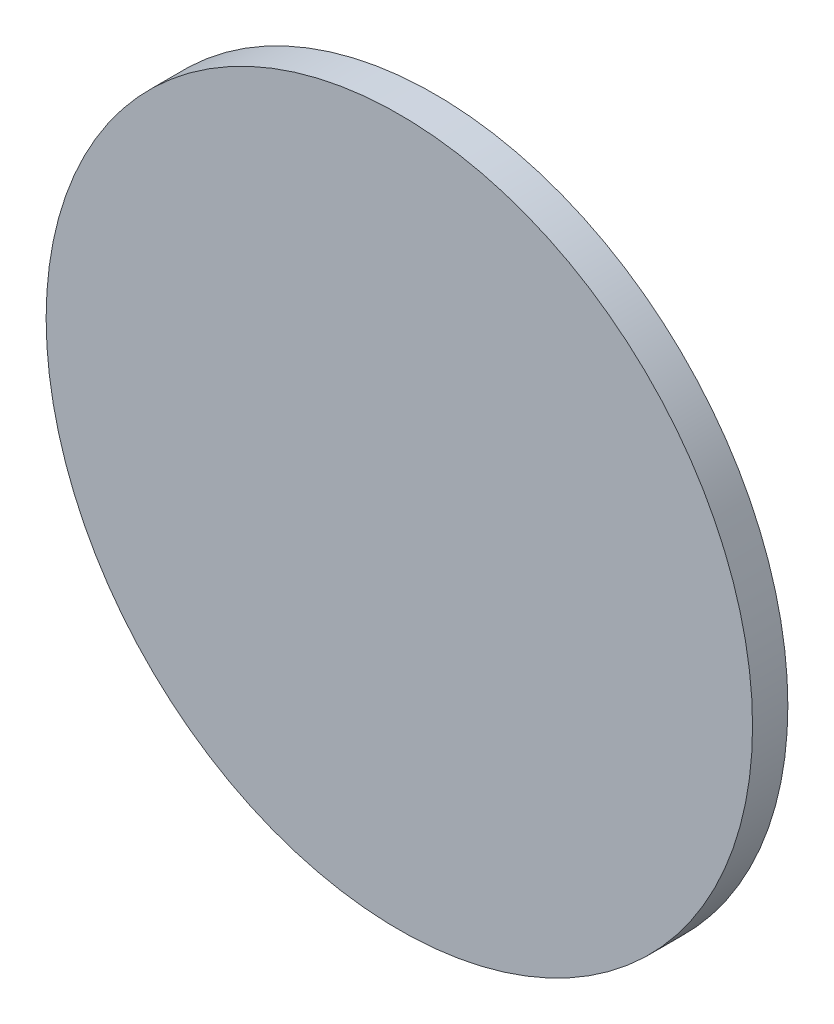
from build123d import *

# Parameters (mm, degrees)
SKETCH1_R           = 50
BOSS_EXTRUDE1_DEPTH = 5
SKETCH2_W           = 34
SKETCH2_H           = 70
BOSS_EXTRUDE3_DEPTH = 8
SKETCH3_W           = 27
SKETCH3_H           = 63
CUT_EXTRUDE1_DEPTH  = 8
SKETCH4_W           = 4
SKETCH4_H           = 4
CUT_EXTRUDE2_DEPTH  = 99.939375377
LPATTERN1_COUNT     = 3
LPATTERN1_PITCH     = 10
SKETCH5_W           = 4
SKETCH5_H           = 4
CUT_EXTRUDE3_DEPTH  = 84.982140959
LPATTERN2_COUNT     = 8
LPATTERN2_PITCH     = 8


with BuildPart() as part:
    # Sketch1 → Boss-Extrude1 (new body)
    with BuildSketch(Plane.XY):
        Circle(SKETCH1_R)
    extrude(amount=BOSS_EXTRUDE1_DEPTH)

    # Sketch2 → Boss-Extrude3 (add)
    with BuildSketch(Plane(origin=(0, 0, 0), x_dir=(-1, 0, 0), z_dir=(0, 0, -1))):
        Rectangle(SKETCH2_W, SKETCH2_H)
    extrude(amount=BOSS_EXTRUDE3_DEPTH)

    # Sketch3 → Cut-Extrude1 (cut)
    with BuildSketch(Plane(origin=(0, 0, -8), x_dir=(-1, 0, 0), z_dir=(0, 0, -1))):
        Rectangle(SKETCH3_W, SKETCH3_H)
    extrude(amount=-CUT_EXTRUDE1_DEPTH, mode=Mode.SUBTRACT)

    # Sketch4 → Cut-Extrude2 (cut, through all)
    with BuildSketch(Plane.XZ.offset(35)):
        with Locations((-10, -4)):
            Rectangle(SKETCH4_W, SKETCH4_H)
    cut_extrude2 = extrude(amount=-CUT_EXTRUDE2_DEPTH, mode=Mode.SUBTRACT)

    # LPattern1: Cut-Extrude2 ×3
    with Locations(*[(i * LPATTERN1_PITCH, 0, 0) for i in range(1, LPATTERN1_COUNT)]):
        add(cut_extrude2, mode=Mode.SUBTRACT)

    # Sketch5 → Cut-Extrude3 (cut, through all)
    with BuildSketch(Plane.ZY.offset(17)):
        with Locations((-4, 28)):
            Rectangle(SKETCH5_W, SKETCH5_H)
    cut_extrude3 = extrude(amount=-CUT_EXTRUDE3_DEPTH, mode=Mode.SUBTRACT)

    # LPattern2: Cut-Extrude3 ×8
    with Locations(*[(0, -i * LPATTERN2_PITCH, 0) for i in range(1, LPATTERN2_COUNT)]):
        add(cut_extrude3, mode=Mode.SUBTRACT)


solid = part.part
